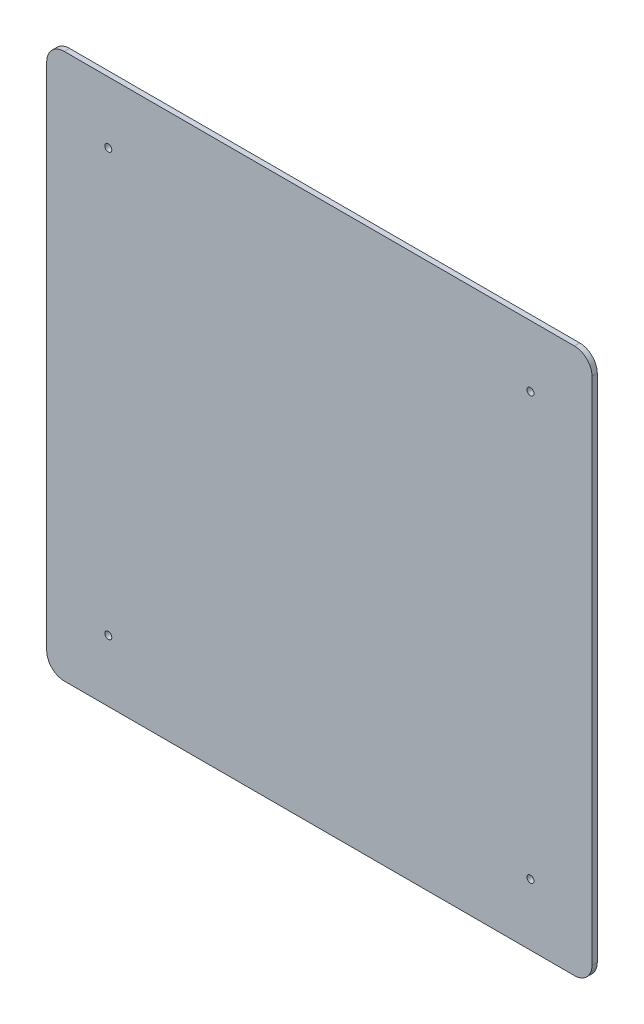
from build123d import *

# Parameters (mm, degrees)
SKETCH_1_R      = 2
EXTRUDE_1_DEPTH = 3


with BuildPart() as part:
    # 草图1 → 凸台-拉伸1 (new body)
    with BuildSketch(Plane.XY):
        with BuildLine():
            Line((-157.58302583, 164.437269373), (132.41697417, 164.437269373))
            ThreePointArc((132.41697417, 164.437269373), (139.488041982, 161.508337185), (142.41697417, 154.437269373))
            Line((142.41697417, 154.437269373), (142.41697417, -135.562730627))
            ThreePointArc((142.41697417, -135.562730627), (139.488041982, -142.633798439), (132.41697417, -145.562730627))
            Line((132.41697417, -145.562730627), (-157.58302583, -145.562730627))
            ThreePointArc((-157.58302583, -145.562730627), (-164.654093642, -142.633798439), (-167.58302583, -135.562730627))
            Line((-167.58302583, -135.562730627), (-167.58302583, 154.437269373))
            ThreePointArc((-167.58302583, 154.437269373), (-164.654093642, 161.508337185), (-157.58302583, 164.437269373))
        make_face()
        with Locations((107.41697417, 129.437269373)):
            Circle(SKETCH_1_R, mode=Mode.SUBTRACT)
        with Locations((107.41697417, -110.562730627)):
            Circle(SKETCH_1_R, mode=Mode.SUBTRACT)
        with Locations((-132.58302583, 129.437269373)):
            Circle(SKETCH_1_R, mode=Mode.SUBTRACT)
        with Locations((-132.58302583, -110.562730627)):
            Circle(SKETCH_1_R, mode=Mode.SUBTRACT)
    extrude(amount=EXTRUDE_1_DEPTH)


solid = part.part
